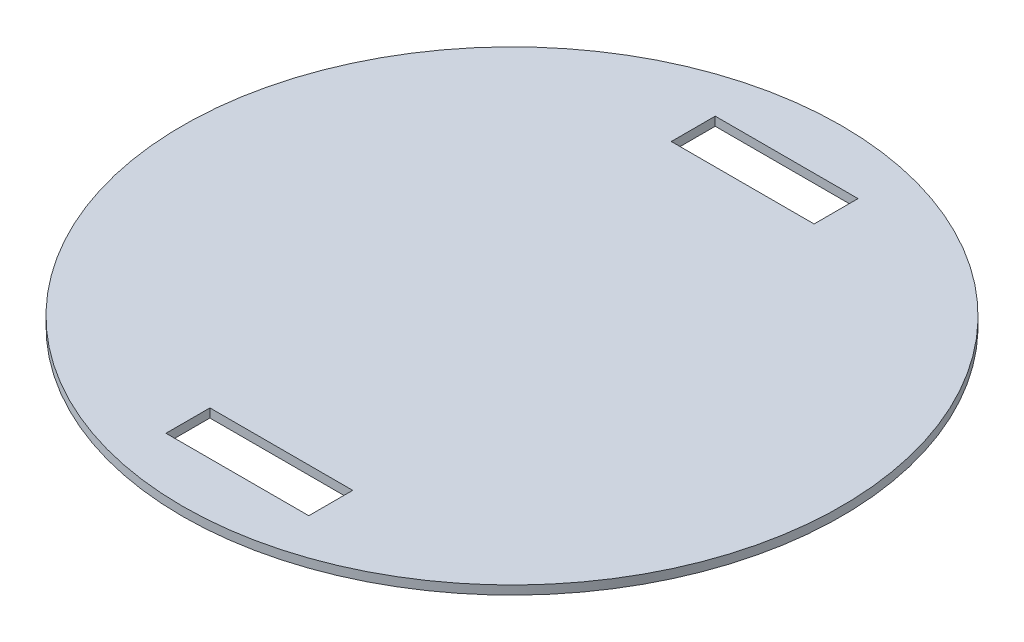
from build123d import *

# Parameters (mm, degrees)
ESQUISSE2_R             = 150
BOSS_EXTRU_1_DEPTH      = 4
ESQUISSE4_W             = 65
ESQUISSE4_H             = 20
ENL_V_MAT_EXTRU_1_DEPTH = 213.169743366


with BuildPart() as part:
    # Esquisse2 → Boss.-Extru.1 (new body)
    with BuildSketch(Plane(origin=(0, 0, 0), x_dir=(1, 0, 0), z_dir=(0, 1, 0))):
        with Locations(Location((0, 0, 0), (0, 0, 270))):
            Circle(ESQUISSE2_R)
    extrude(amount=-BOSS_EXTRU_1_DEPTH)

    # Esquisse4 → Enlèv. mat.-Extru.1 (cut, through all)
    with BuildSketch(Plane(origin=(0, 0, 0), x_dir=(1, 0, 0), z_dir=(0, 1, 0))):
        with Locations((0, -115)):
            Rectangle(ESQUISSE4_W, ESQUISSE4_H)
        with Locations((0, 115)):
            Rectangle(ESQUISSE4_W, ESQUISSE4_H)
    extrude(amount=-ENL_V_MAT_EXTRU_1_DEPTH, mode=Mode.SUBTRACT)


solid = part.part
